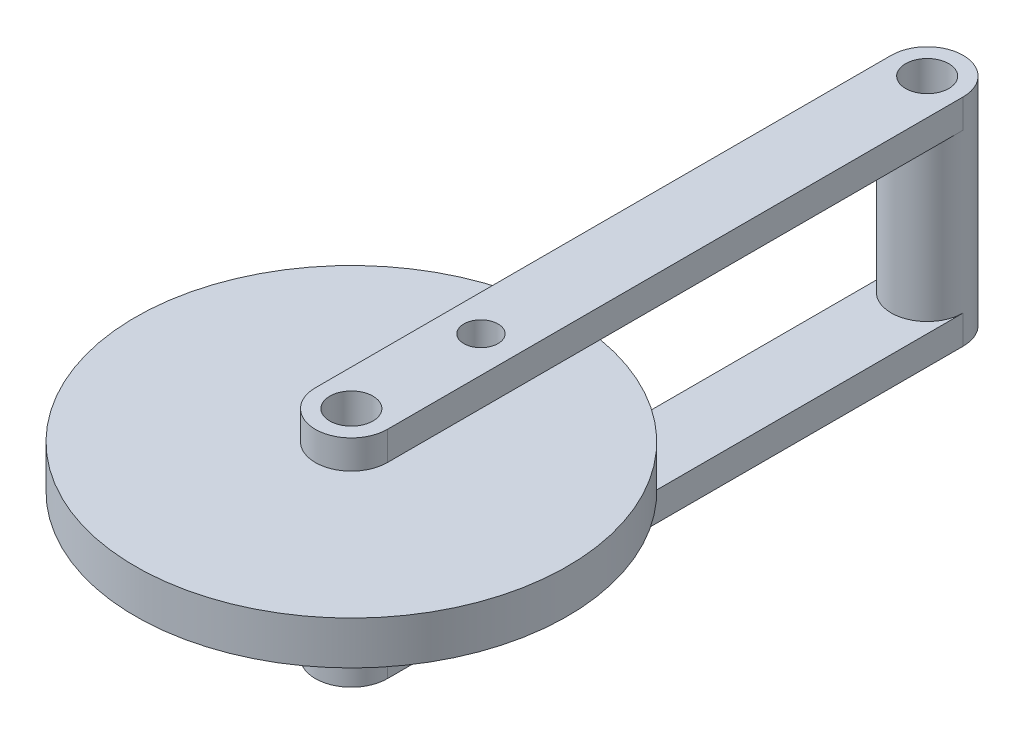
from build123d import *
from build123d.topology import SkipClean

# Parameters (mm, degrees)
BOSS_EXTRUDE1_DEPTH             = 2
SKETCH2_R                       = 2.5
BOSS_EXTRUDE2_DEPTH             = 11
BOSS_EXTRUDE3_START             = 13
BOSS_EXTRUDE3_DEPTH             = 2
SKETCH7_R                       = 15
BOSS_EXTRUDE5_DEPTH             = 3
F_3_0MM_CLEARANCE_DOWEL_HOLE1_D = 3
F_4_48_TAPPED_HOLE1_D           = 2.3749
F_4_48_TAPPED_HOLE1_DEPTH       = 7.27
F_4_48_TAPPED_HOLE1_TIP         = 0.713491942


with BuildPart() as part:
    # Sketch1 → Boss-Extrude1 (new body)
    with BuildSketch(Plane(origin=(0, 0, 0), x_dir=(1, 0, 0), z_dir=(0, 1, 0))):
        with BuildLine():
            Line((2.5, 0), (2.5, -40))
            ThreePointArc((2.5, -40), (0, -42.5), (-2.5, -40))
            Line((-2.5, -40), (-2.5, 0))
            ThreePointArc((-2.5, 0), (0, 2.5), (2.5, 0))
        make_face()
    extrude(amount=BOSS_EXTRUDE1_DEPTH)

    # Sketch2 → Boss-Extrude2 (add)
    with SkipClean():  # the faces are left unmerged after this step: merging them gives an invalid solid
        with BuildSketch(Plane(origin=(0, 2, 0), x_dir=(1, 0, 0), z_dir=(0, 1, 0))):
            Circle(SKETCH2_R)
        extrude(amount=BOSS_EXTRUDE2_DEPTH)
    add(part.part.scale(1), mode=Mode.REPLACE)  # the faces are merged on a copy

    # Sketch1<3> → Boss-Extrude3 (add)
    with SkipClean():  # the faces are left unmerged after this step: merging them gives an invalid solid
        with BuildSketch(Plane(origin=(0, 0, 0), x_dir=(1, 0, 0), z_dir=(0, 1, 0)).offset(BOSS_EXTRUDE3_START)):
            with BuildLine():
                Line((2.5, 0), (2.5, -40))
                ThreePointArc((2.5, -40), (0, -42.5), (-2.5, -40))
                Line((-2.5, -40), (-2.5, 0))
                ThreePointArc((-2.5, 0), (0, 2.5), (2.5, 0))
            make_face()
        extrude(amount=BOSS_EXTRUDE3_DEPTH)
    add(part.part.scale(1), mode=Mode.REPLACE)  # the faces are merged on a copy

    # Sketch7 → Boss-Extrude5 (add)
    with BuildSketch(Plane.XZ.offset(-13)):
        with Locations((0, 40)):
            Circle(SKETCH7_R)
    extrude(amount=BOSS_EXTRUDE5_DEPTH)

    # Ø3.0mm Clearance Dowel Hole1 (through all)
    with Locations(Plane(origin=(0, 15, 0), x_dir=(1, 0, 0), z_dir=(0, 1, 0))):
        with Locations((0, 0), (0, -40)):
            Hole(F_3_0MM_CLEARANCE_DOWEL_HOLE1_D / 2)

    # #4-48 Tapped Hole1
    with Locations(Plane(origin=(0, 15, 0), x_dir=(1, 0, 0), z_dir=(0, 1, 0))):
        with Locations((0, -31)):
            Hole(F_4_48_TAPPED_HOLE1_D / 2, depth=F_4_48_TAPPED_HOLE1_DEPTH)
            with Locations((0, 0, -(F_4_48_TAPPED_HOLE1_DEPTH + F_4_48_TAPPED_HOLE1_TIP / 2))):  # 118° drill point
                Cone(0, F_4_48_TAPPED_HOLE1_D / 2, F_4_48_TAPPED_HOLE1_TIP, mode=Mode.SUBTRACT)


solid = part.part
